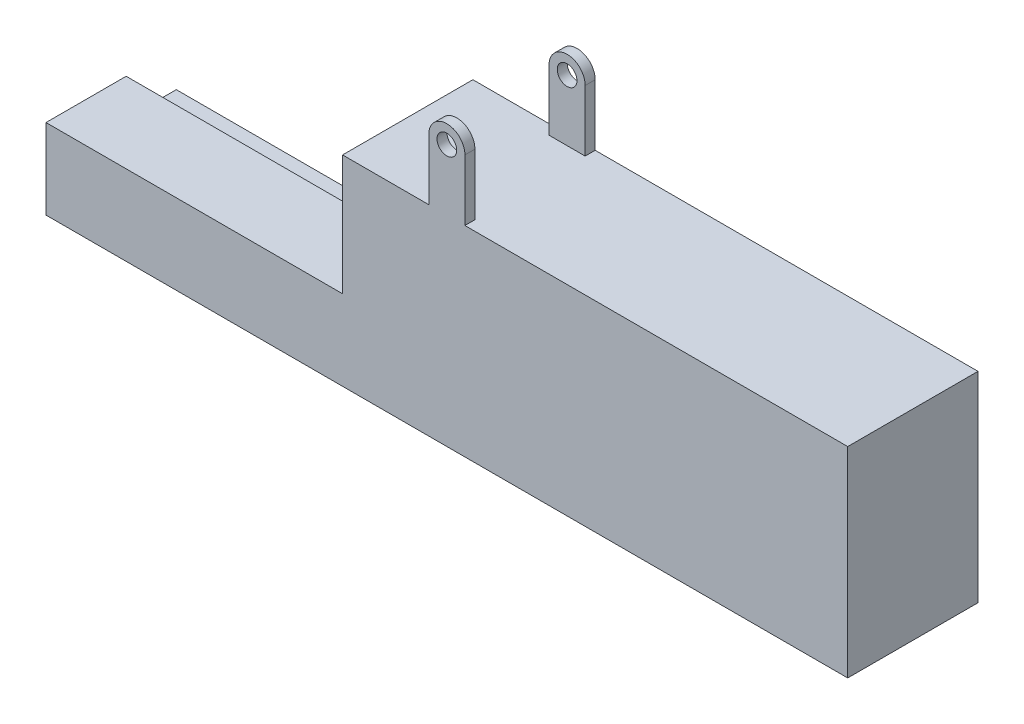
from build123d import *

# Parameters (mm, degrees)
SKETCH1_W           = 203.2
SKETCH1_H           = 33.02
BOSS_EXTRUDE1_DEPTH = 50.8
SKETCH4_W           = 75.174345078
SKETCH4_H           = 39.769068734
CUT_EXTRUDE2_DEPTH  = 119.294211186
SKETCH5_W           = 75.174345078
SKETCH5_H           = 9.289068734
BOSS_EXTRUDE3_DEPTH = 20.32
BOSS_EXTRUDE4_START = 15.24
SKETCH6_R           = 2.5
BOSS_EXTRUDE4_DEPTH = 1.27
BOSS_EXTRUDE5_START = -15.24
SKETCH6_3_R         = 2.5
BOSS_EXTRUDE5_DEPTH = 1.27


with BuildPart() as part:
    # Sketch1 → Boss-Extrude1 (new body)
    with BuildSketch(Plane(origin=(0, 0, 0), x_dir=(1, 0, 0), z_dir=(0, 1, 0))):
        Rectangle(SKETCH1_W, SKETCH1_H)
    extrude(amount=BOSS_EXTRUDE1_DEPTH)

    # Sketch4 → Cut-Extrude2 (cut, through all)
    with BuildSketch(Plane.XY.offset(16.51)):
        with Locations((-64.012827461, 30.915465633)):
            Rectangle(SKETCH4_W, SKETCH4_H)
    extrude(amount=-CUT_EXTRUDE2_DEPTH, mode=Mode.SUBTRACT)

    # Sketch5 → Boss-Extrude3 (add)
    with BuildSketch(Plane.XY.offset(16.51)):
        with Locations((-64.012827461, 15.675465633)):
            Rectangle(SKETCH5_W, SKETCH5_H)
    extrude(amount=-BOSS_EXTRUDE3_DEPTH)

    # Sketch6 → Boss-Extrude4 (add, symmetric)
    with BuildSketch(Plane.XY.offset(BOSS_EXTRUDE4_START)):
        with BuildLine():
            Line((-4.572, 66.294), (-4.572, 50.8))
            Line((-4.572, 50.8), (4.572, 50.8))
            Line((4.572, 50.8), (4.572, 66.294))
            ThreePointArc((4.572, 66.294), (0, 70.866), (-4.572, 66.294))
        make_face()
        with Locations((0, 66.294)):
            Circle(SKETCH6_R, mode=Mode.SUBTRACT)
    extrude(amount=BOSS_EXTRUDE4_DEPTH, both=True)

    # Sketch6<3> → Boss-Extrude5 (add, symmetric)
    with BuildSketch(Plane.XY.offset(BOSS_EXTRUDE5_START)):
        with BuildLine():
            Line((-4.572, 50.8), (-4.572, 66.294))
            ThreePointArc((-4.572, 66.294), (0, 70.866), (4.572, 66.294))
            Line((4.572, 66.294), (4.572, 50.8))
            Line((4.572, 50.8), (-4.572, 50.8))
        make_face()
        with Locations((0, 66.294)):
            Circle(SKETCH6_3_R, mode=Mode.SUBTRACT)
    extrude(amount=BOSS_EXTRUDE5_DEPTH, both=True)


solid = part.part
